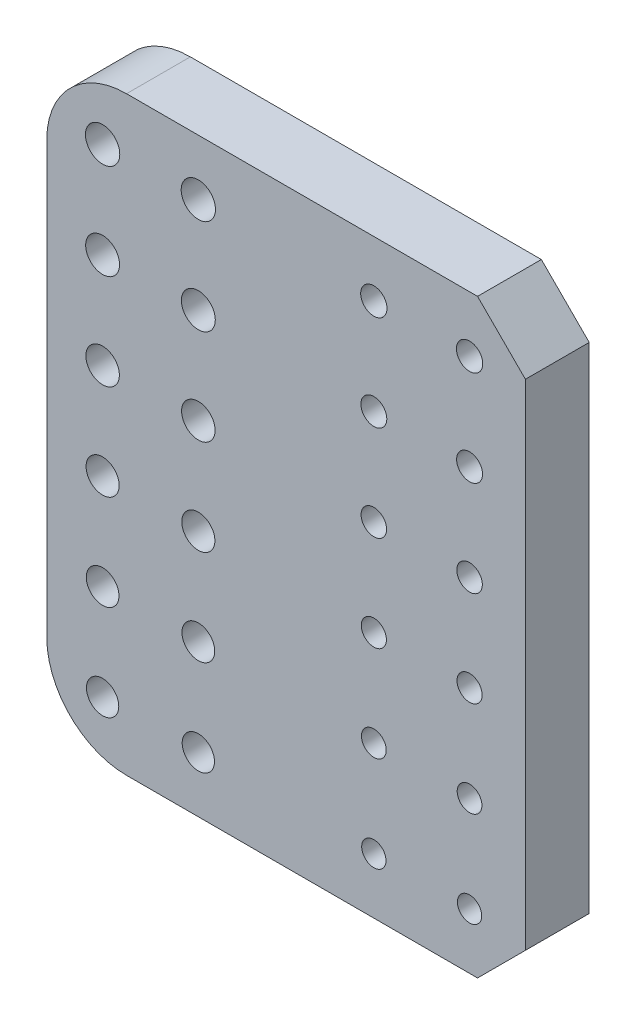
from build123d import *

# Parameters (mm, degrees)
SKETCH1_W           = 60
SKETCH1_H           = 74
BOSS_EXTRUDE1_DEPTH = 12
SKETCH3_R           = 1.65
SKETCH3_R_2         = 1.15
CUT_EXTRUDE1_DEPTH  = 50.122296363
CHAMFER1_SIZE       = 6
FILLET1_R           = 10
SKETCH4_R           = 2.9
SKETCH4_R_2         = 2.4
CUT_EXTRUDE2_DEPTH  = 4
SKETCH6_R           = 2.15
SKETCH6_R_2         = 2.125
SKETCH6_R_3         = 2.1
SKETCH6_R_4         = 2.075
SKETCH6_R_5         = 2.05
SKETCH6_R_6         = 2.025
SKETCH6_R_7         = 1.525
SKETCH6_R_8         = 1.55
SKETCH6_R_9         = 1.575
SKETCH6_R_10        = 1.6
SKETCH6_R_11        = 1.625
SKETCH6_R_12        = 1.65
CUT_EXTRUDE3_DEPTH  = 3.1
SKETCH8_W           = 4
SKETCH8_H           = 74
CUT_EXTRUDE4_DEPTH  = 72.505244563


with BuildPart() as part:
    # Sketch1 → Boss-Extrude1 (new body)
    with BuildSketch(Plane.XY):
        Rectangle(SKETCH1_W, SKETCH1_H)
    extrude(amount=BOSS_EXTRUDE1_DEPTH)

    # Sketch3 → Cut-Extrude1 (cut, through all)
    with BuildSketch(Plane.XY.offset(12)):
        with Locations((-23, -30)):
            Circle(SKETCH3_R)
        with Locations((23, -30)):
            Circle(SKETCH3_R_2)
        with Locations((-11, -30)):
            Circle(SKETCH3_R)
        with Locations((-11, -18)):
            Circle(SKETCH3_R)
        with Locations((-11, -6)):
            Circle(SKETCH3_R)
        with Locations((-11, 6)):
            Circle(SKETCH3_R)
        with Locations((-23, -18)):
            Circle(SKETCH3_R)
        with Locations((-23, -6)):
            Circle(SKETCH3_R)
        with Locations((-23, 6)):
            Circle(SKETCH3_R)
        with Locations((11, -30)):
            Circle(SKETCH3_R_2)
        with Locations((11, -18)):
            Circle(SKETCH3_R_2)
        with Locations((11, -6)):
            Circle(SKETCH3_R_2)
        with Locations((11, 6)):
            Circle(SKETCH3_R_2)
        with Locations((23, -18)):
            Circle(SKETCH3_R_2)
        with Locations((23, -6)):
            Circle(SKETCH3_R_2)
        with Locations((23, 6)):
            Circle(SKETCH3_R_2)
        with Locations((-23, 18)):
            Circle(SKETCH3_R)
        with Locations((-11, 18)):
            Circle(SKETCH3_R)
        with Locations((-23, 30)):
            Circle(SKETCH3_R)
        with Locations((-11, 30)):
            Circle(SKETCH3_R)
        with Locations((23, 18)):
            Circle(SKETCH3_R_2)
        with Locations((11, 18)):
            Circle(SKETCH3_R_2)
        with Locations((23, 30)):
            Circle(SKETCH3_R_2)
        with Locations((11, 30)):
            Circle(SKETCH3_R_2)
    extrude(amount=-CUT_EXTRUDE1_DEPTH, mode=Mode.SUBTRACT)

    # Chamfer1
    chamfer1_edges = [part.edges().sort_by_distance(p)[0] for p in [
        (30, 37, 6),
        (30, -37, 6),
    ]]
    chamfer(chamfer1_edges, length=CHAMFER1_SIZE)

    # Fillet1
    fillet1_edges = [part.edges().sort_by_distance(p)[0] for p in [
        (-30, 37, 6),
        (-30, -37, 6),
    ]]
    fillet(fillet1_edges, radius=FILLET1_R)

    # Sketch4 → Cut-Extrude2 (cut)
    with BuildSketch(Plane.XY.offset(12)):
        with Locations((-23, -30)):
            Circle(SKETCH4_R)
        with Locations((-11, -30)):
            Circle(SKETCH4_R)
        with Locations((-11, -18)):
            Circle(SKETCH4_R)
        with Locations((-11, -6)):
            Circle(SKETCH4_R)
        with Locations((-11, 6)):
            Circle(SKETCH4_R)
        with Locations((-23, -18)):
            Circle(SKETCH4_R)
        with Locations((-23, -6)):
            Circle(SKETCH4_R)
        with Locations((-23, 6)):
            Circle(SKETCH4_R)
        with Locations((11, -30)):
            Circle(SKETCH4_R_2)
        with Locations((23, -30)):
            Circle(SKETCH4_R_2)
        with Locations((23, -18)):
            Circle(SKETCH4_R_2)
        with Locations((23, -6)):
            Circle(SKETCH4_R_2)
        with Locations((23, 6)):
            Circle(SKETCH4_R_2)
        with Locations((11, -18)):
            Circle(SKETCH4_R_2)
        with Locations((11, -6)):
            Circle(SKETCH4_R_2)
        with Locations((11, 6)):
            Circle(SKETCH4_R_2)
        with Locations((-23, 18)):
            Circle(SKETCH4_R)
        with Locations((-11, 18)):
            Circle(SKETCH4_R)
        with Locations((-23, 30)):
            Circle(SKETCH4_R)
        with Locations((-11, 30)):
            Circle(SKETCH4_R)
        with Locations((11, 18)):
            Circle(SKETCH4_R_2)
        with Locations((23, 18)):
            Circle(SKETCH4_R_2)
        with Locations((11, 30)):
            Circle(SKETCH4_R_2)
        with Locations((23, 30)):
            Circle(SKETCH4_R_2)
    extrude(amount=-CUT_EXTRUDE2_DEPTH, mode=Mode.SUBTRACT)

    # Sketch6 → Cut-Extrude3 (cut)
    with BuildSketch(Plane.XY.offset(8)):
        with Locations((-23, 30)):
            Circle(SKETCH6_R)
        with Locations((-23, 18)):
            Circle(SKETCH6_R_2)
        with Locations((-23, 6)):
            Circle(SKETCH6_R_3)
        with Locations((-23, -6)):
            Circle(SKETCH6_R_4)
        with Locations((-23, -18)):
            Circle(SKETCH6_R_5)
        with Locations((-23, -30)):
            Circle(SKETCH6_R_6)
        with Locations((-11, 30)):
            Circle(SKETCH6_R)
        with Locations((11, -30)):
            Circle(SKETCH6_R_7)
        with Locations((11, -18)):
            Circle(SKETCH6_R_8)
        with Locations((11, -6)):
            Circle(SKETCH6_R_9)
        with Locations((11, 6)):
            Circle(SKETCH6_R_10)
        with Locations((11, 18)):
            Circle(SKETCH6_R_11)
        with Locations((11, 30)):
            Circle(SKETCH6_R_12)
        with Locations((-11, 18)):
            Circle(SKETCH6_R_2)
        with Locations((-11, 6)):
            Circle(SKETCH6_R_3)
        with Locations((-11, -6)):
            Circle(SKETCH6_R_4)
        with Locations((-11, -18)):
            Circle(SKETCH6_R_5)
        with Locations((-11, -30)):
            Circle(SKETCH6_R_6)
        with Locations((23, -30)):
            Circle(SKETCH6_R_7)
        with Locations((23, -18)):
            Circle(SKETCH6_R_8)
        with Locations((23, -6)):
            Circle(SKETCH6_R_9)
        with Locations((23, 6)):
            Circle(SKETCH6_R_10)
        with Locations((23, 18)):
            Circle(SKETCH6_R_11)
        with Locations((23, 30)):
            Circle(SKETCH6_R_12)
    extrude(amount=-CUT_EXTRUDE3_DEPTH, mode=Mode.SUBTRACT)

    # Sketch8 → Cut-Extrude4 (cut, through all)
    with BuildSketch(Plane.ZY.offset(30)):
        with Locations((10, 0)):
            Rectangle(SKETCH8_W, SKETCH8_H)
    extrude(amount=-CUT_EXTRUDE4_DEPTH, mode=Mode.SUBTRACT)


solid = part.part
